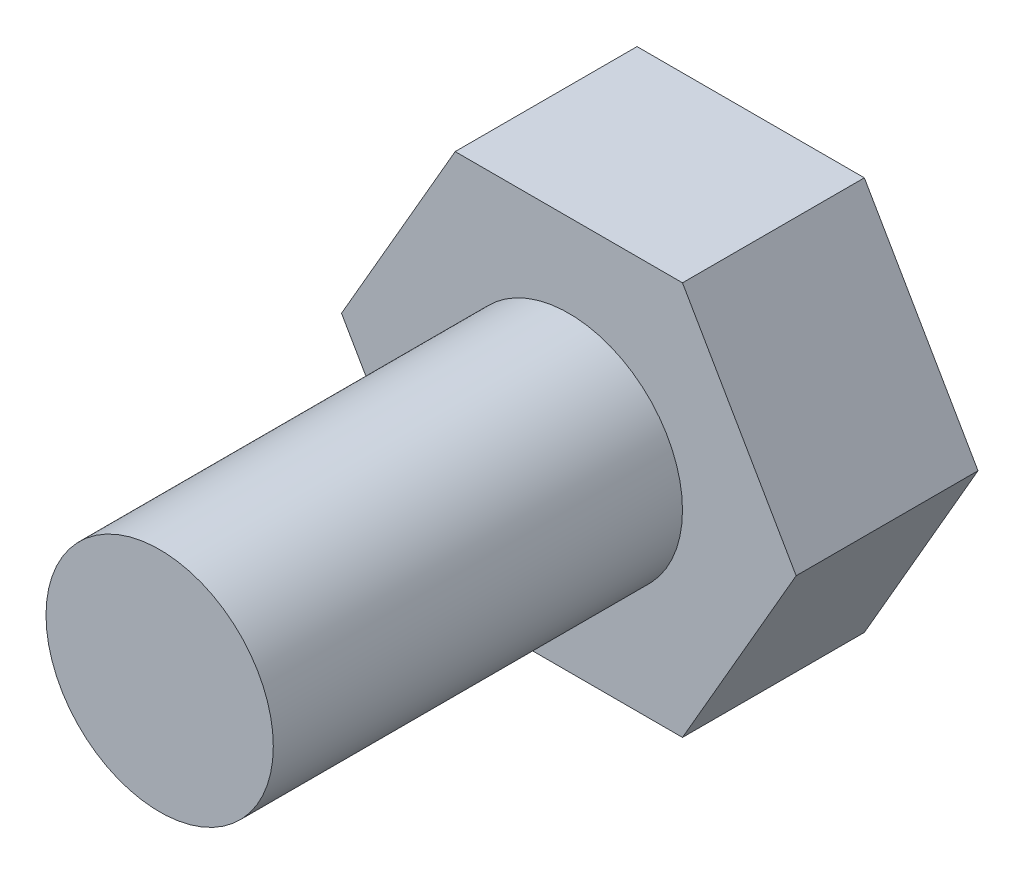
from build123d import *

# Parameters (mm, degrees)
BOSS_EXTRUDE1_DEPTH = 2
SKETCH2_R           = 2.5
BOSS_EXTRUDE2_DEPTH = 9


with BuildPart() as part:
    # Sketch1 → Boss-Extrude1 (new, symmetric)
    with BuildSketch(Plane.XY):
        Polygon((5, 0), (2.5, 4.330127019), (-2.5, 4.330127019), (-5, 0), (-2.5, -4.330127019), (2.5, -4.330127019), align=None)
    extrude(amount=BOSS_EXTRUDE1_DEPTH, both=True)

    # Sketch2 → Boss-Extrude2 (add)
    with BuildSketch(Plane.XY.offset(2)):
        Circle(SKETCH2_R)
    extrude(amount=BOSS_EXTRUDE2_DEPTH)


solid = part.part
